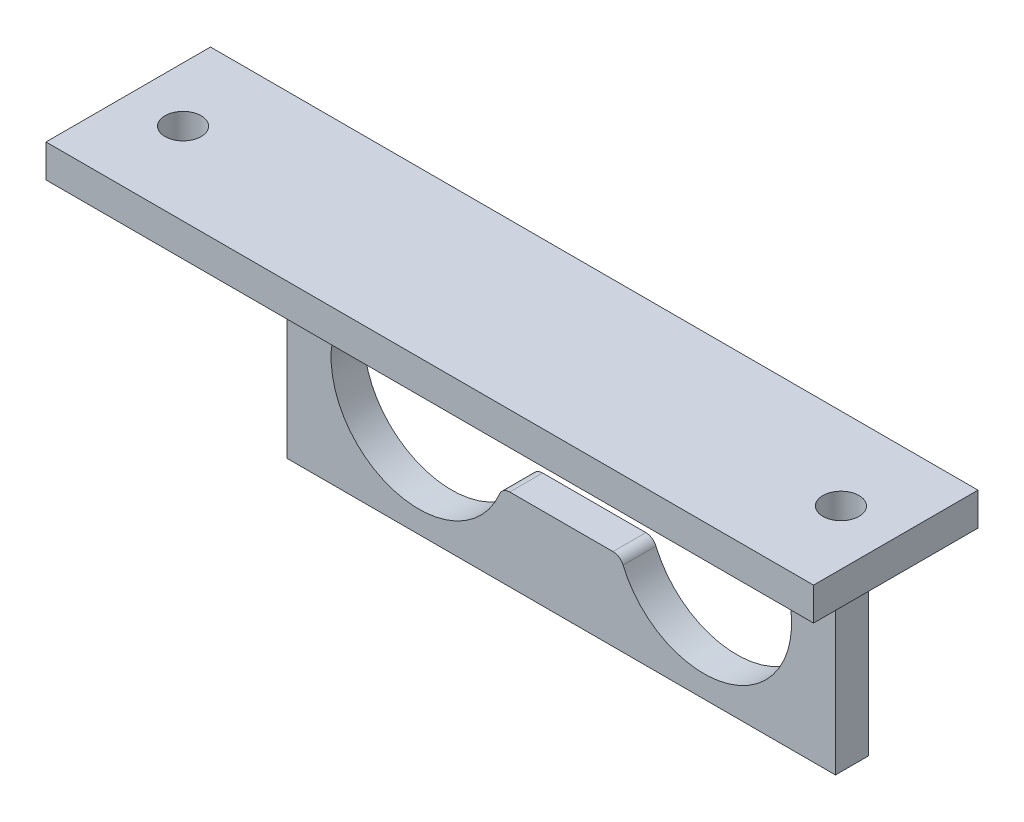
from build123d import *

# Parameters (mm, degrees)
SKETCH_1_W          = 50
SKETCH_1_H          = 20
EXTRUDE_1_DEPTH     = 3
SKETCH_2_W          = 50
SKETCH_2_H          = 15
EXTRUDE_2_DEPTH     = 6
SKETCH_5_W          = 50
SKETCH_5_H          = 12
CUT_EXTRUDE_2_DEPTH = 3
SKETCH_6_W          = 10
SKETCH_6_H          = 15
SKETCH_6_R          = 1.65
EXTRUDE_3_DEPTH     = 3
FILLET_1_R          = 1


with BuildPart() as part:
    # 草图1 → 凸台-拉伸1 (new body)
    with BuildSketch(Plane.XY):
        Rectangle(SKETCH_1_W, SKETCH_1_H)
        with BuildLine():
            Line((-4.708438024, 2.5), (4.708438024, 2.5))
            ThreePointArc((4.708438024, 2.5), (5.261208823, 2.666666667), (5.629722688, 3.111111111))
            ThreePointArc((5.629722688, 3.111111111), (21, 0), (5.629722688, -3.111111111))
            ThreePointArc((5.629722688, -3.111111111), (5.261208823, -2.666666667), (4.708438024, -2.5))
            Line((4.708438024, -2.5), (-4.708438024, -2.5))
            ThreePointArc((-4.708438024, -2.5), (-5.261208823, -2.666666667), (-5.629722688, -3.111111111))
            ThreePointArc((-5.629722688, -3.111111111), (-21, 0), (-5.629722688, 3.111111111))
            ThreePointArc((-5.629722688, 3.111111111), (-5.261208823, 2.666666667), (-4.708438024, 2.5))
        make_face(mode=Mode.SUBTRACT)
        with BuildLine():
            Line((3.25, 5.5), (-3.25, 5.5))
            ThreePointArc((-3.25, 5.5), (-5, 7.25), (-3.25, 9))
            Line((-3.25, 9), (3.25, 9))
            ThreePointArc((3.25, 9), (5, 7.25), (3.25, 5.5))
        make_face(mode=Mode.SUBTRACT)
    extrude(amount=EXTRUDE_1_DEPTH)

    # 草图2 → 凸台-拉伸2 (add)
    with BuildSketch(Plane(origin=(0, 10, 0), x_dir=(1, 0, 0), z_dir=(0, 1, 0))):
        with Locations((0, -7.5)):
            Rectangle(SKETCH_2_W, SKETCH_2_H)
    extrude(amount=EXTRUDE_2_DEPTH)

    # 草图5 → 切除-拉伸2 (cut)
    with BuildSketch(Plane.XZ.offset(-10)):
        with Locations((0, 9)):
            Rectangle(SKETCH_5_W, SKETCH_5_H)
    extrude(amount=-CUT_EXTRUDE_2_DEPTH, mode=Mode.SUBTRACT)

    # 草图6 → 凸台-拉伸3 (add)
    # profile 1 of 2: a face of its own
    with BuildSketch(Plane(origin=(0, 16, 0), x_dir=(1, 0, 0), z_dir=(0, 1, 0))):
        with Locations((30, -7.5)):
            Rectangle(SKETCH_6_W, SKETCH_6_H)
        with Locations(Location((30, -7.5, 0), (0, 0, 180))):
            Circle(SKETCH_6_R, mode=Mode.SUBTRACT)
    # profile 2 of 2: a face of its own
    with BuildSketch(Plane(origin=(0, 16, 0), x_dir=(1, 0, 0), z_dir=(0, 1, 0))):
        with Locations((-30, -7.5)):
            Rectangle(SKETCH_6_W, SKETCH_6_H)
        with Locations(Location((-30, -7.5, 0), (0, 0, 180))):
            Circle(SKETCH_6_R, mode=Mode.SUBTRACT)
    extrude(amount=-EXTRUDE_3_DEPTH)

    # 圆角1
    fillet_1_edges = [part.edges().sort_by_distance(p)[0] for p in [
        (25, 13, 1.5),
        (-25, 13, 1.5),
    ]]
    fillet(fillet_1_edges, radius=FILLET_1_R)


solid = part.part
